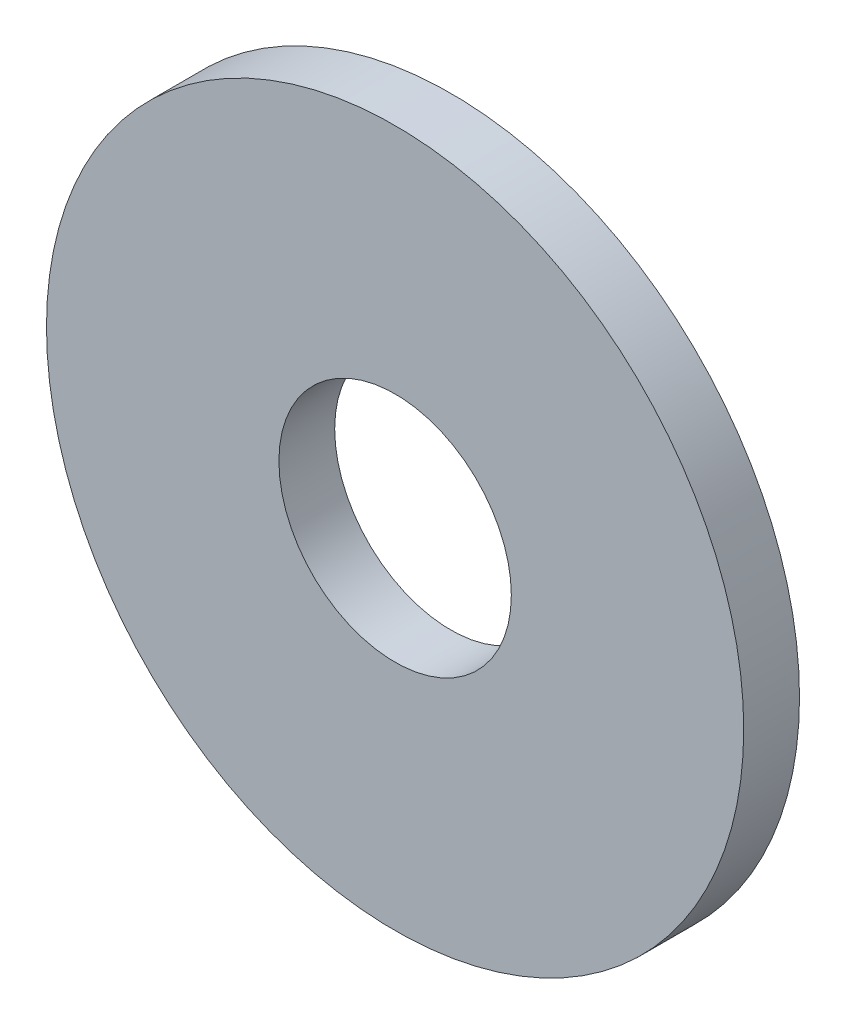
from build123d import *

# Parameters (mm, degrees)
SKETCH1_R           = 7.5
SKETCH1_R_2         = 2.5
BOSS_EXTRUDE1_DEPTH = 1.2


with BuildPart() as part:
    # Sketch1 → Boss-Extrude1 (new body)
    with BuildSketch(Plane.XY):
        Circle(SKETCH1_R)
        Circle(SKETCH1_R_2, mode=Mode.SUBTRACT)
    extrude(amount=BOSS_EXTRUDE1_DEPTH)


solid = part.part
